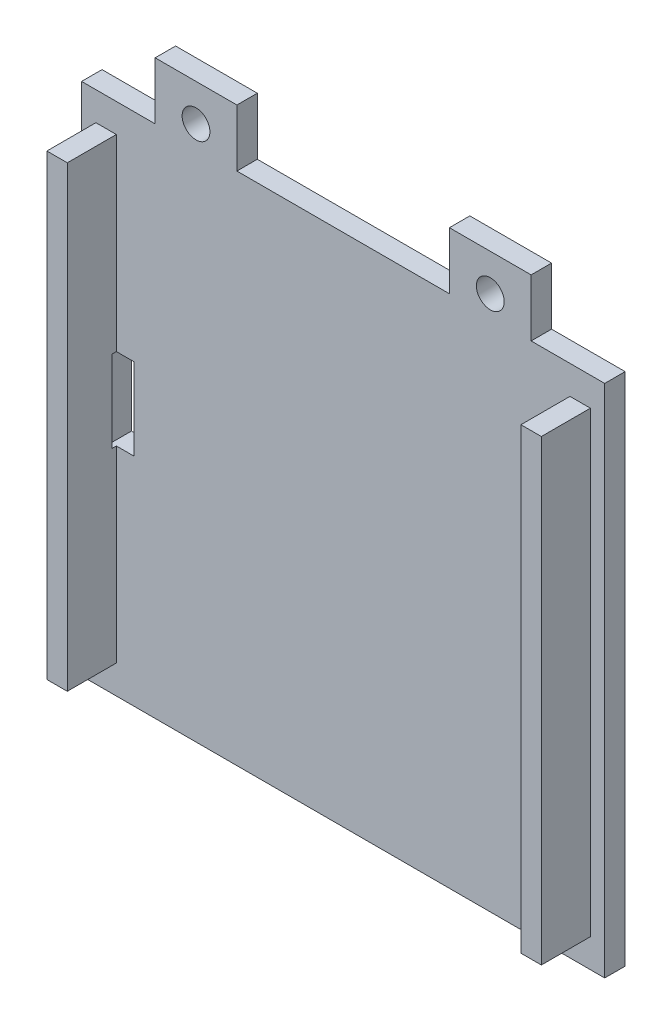
from build123d import *

# Parameters (mm, degrees)
BOARD_SUPPORT_AND_LUGS_DEPTH = 2.5
PCB_EDGE_STOPS_START         = 2.5
SKETCH_PCB_EDGE_STOPS_W      = 2.5
SKETCH_PCB_EDGE_STOPS_H      = 56
PCB_EDGE_STOPS_DEPTH         = 6
BOARD_STRAP_SLOTS_START      = -1
SKETCH_BOARD_STRAP_SLOTS_W   = 2.8
SKETCH_BOARD_STRAP_SLOTS_H   = 10
BOARD_STRAP_SLOTS_DEPTH      = 4
EXTERNAL_M3_MOUNTS_START     = -1
SKETCH_EXTERNAL_M3_MOUNTS_R  = 1.7
EXTERNAL_M3_MOUNTS_DEPTH     = 5


with BuildPart() as part:
    # Sketch_Board_support_and_lugs → Board_support_and_lugs (new body)
    with BuildSketch(Plane.XY):
        Polygon((32, 31.5), (32, -31.5), (-32, -31.5), (-32, 31.5), (-23, 31.5), (-23, 38.5), (-13, 38.5), (-13, 31.5), (13, 31.5), (13, 38.5), (23, 38.5), (23, 31.5), align=None)
    extrude(amount=BOARD_SUPPORT_AND_LUGS_DEPTH)

    # Sketch_PCB_edge_stops → PCB_edge_stops (add)
    with BuildSketch(Plane.XY.offset(PCB_EDGE_STOPS_START)):
        with Locations((-29, 0)):
            Rectangle(SKETCH_PCB_EDGE_STOPS_W, SKETCH_PCB_EDGE_STOPS_H)
        with Locations((29, 0)):
            Rectangle(SKETCH_PCB_EDGE_STOPS_W, SKETCH_PCB_EDGE_STOPS_H)
    extrude(amount=PCB_EDGE_STOPS_DEPTH)

    # Sketch_Board_strap_slots → Board_strap_slots (cut)
    with BuildSketch(Plane.XY.offset(BOARD_STRAP_SLOTS_START)):
        with Locations((-27, 0)):
            Rectangle(SKETCH_BOARD_STRAP_SLOTS_W, SKETCH_BOARD_STRAP_SLOTS_H)
        with Locations((27, 0)):
            Rectangle(SKETCH_BOARD_STRAP_SLOTS_W, SKETCH_BOARD_STRAP_SLOTS_H)
    extrude(amount=BOARD_STRAP_SLOTS_DEPTH, mode=Mode.SUBTRACT)

    # Sketch_External_M3_mounts → External_M3_mounts (cut)
    with BuildSketch(Plane.XY.offset(EXTERNAL_M3_MOUNTS_START)):
        with Locations(Location((-18, 34, 0), (0, 0, 180))):
            Circle(SKETCH_EXTERNAL_M3_MOUNTS_R)
        with Locations(Location((18, 34, 0), (0, 0, 180))):
            Circle(SKETCH_EXTERNAL_M3_MOUNTS_R)
    extrude(amount=EXTERNAL_M3_MOUNTS_DEPTH, mode=Mode.SUBTRACT)


solid = part.part
